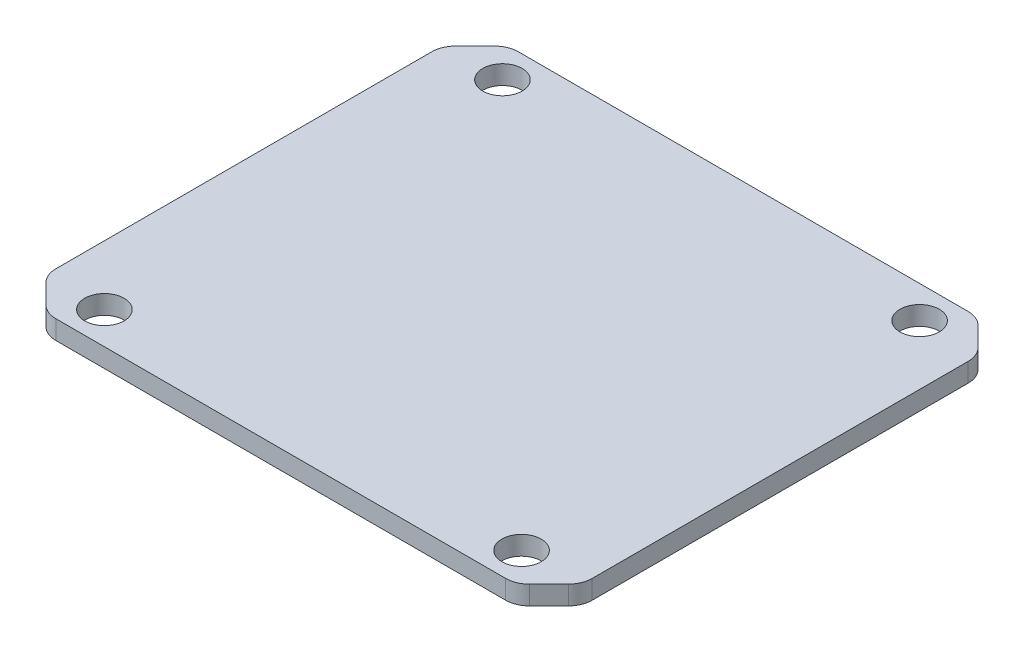
from build123d import *

# Parameters (mm, degrees)
SKETCH1_W               = 45
SKETCH1_H               = 38.8
BOSS_EXTRUDE1_DEPTH     = 0.79375
CUT_EXTRUDE1_DEPTH      = 30.751137058
CUT_EXTRUDE1_DEPTH_BACK = 30.751137058
SKETCH2_R               = 1.65
CHAMFER1_SIZE           = 2.8
FILLET1_R               = 2


with BuildPart() as part:
    # Sketch1 → Boss-Extrude1 (new, symmetric)
    with BuildSketch(Plane(origin=(0, 0, 0), x_dir=(1, 0, 0), z_dir=(0, 1, 0))):
        Rectangle(SKETCH1_W, SKETCH1_H)
    extrude(amount=BOSS_EXTRUDE1_DEPTH, both=True)

    # Sketch2 → Cut-Extrude1 (cut, two sides: drawn at the far end of the back side and taken through both)
    with BuildSketch(Plane(origin=(0, 0.79375, 0), x_dir=(1, 0, 0), z_dir=(0, 1, 0)).offset(-CUT_EXTRUDE1_DEPTH_BACK)):
        with Locations(Location((-17.5, 16.7, 0), (0, 0, 270))):
            Circle(SKETCH2_R)
        with Locations(Location((17.5, 16.7, 0), (0, 0, 270))):
            Circle(SKETCH2_R)
        with Locations(Location((17.5, -16.7, 0), (0, 0, 270))):
            Circle(SKETCH2_R)
        with Locations(Location((-17.5, -16.7, 0), (0, 0, 270))):
            Circle(SKETCH2_R)
    extrude(amount=CUT_EXTRUDE1_DEPTH + CUT_EXTRUDE1_DEPTH_BACK, mode=Mode.SUBTRACT)

    # Chamfer1
    chamfer1_edges = [part.edges().sort_by_distance(p)[0] for p in [
        (22.5, 0, 19.4),
        (-22.5, 0, 19.4),
        (-22.5, 0, -19.4),
        (22.5, 0, -19.4),
    ]]
    chamfer(chamfer1_edges, length=CHAMFER1_SIZE)

    # Fillet1
    fillet1_edges = [part.edges().sort_by_distance(p)[0] for p in [
        (19.7, 0, 19.4),
        (-19.7, 0, 19.4),
        (-22.5, 0, -16.6),
        (-22.5, 0, 16.6),
        (19.7, 0, -19.4),
        (-19.7, 0, -19.4),
        (22.5, 0, 16.6),
        (22.5, 0, -16.6),
    ]]
    fillet(fillet1_edges, radius=FILLET1_R)


solid = part.part
